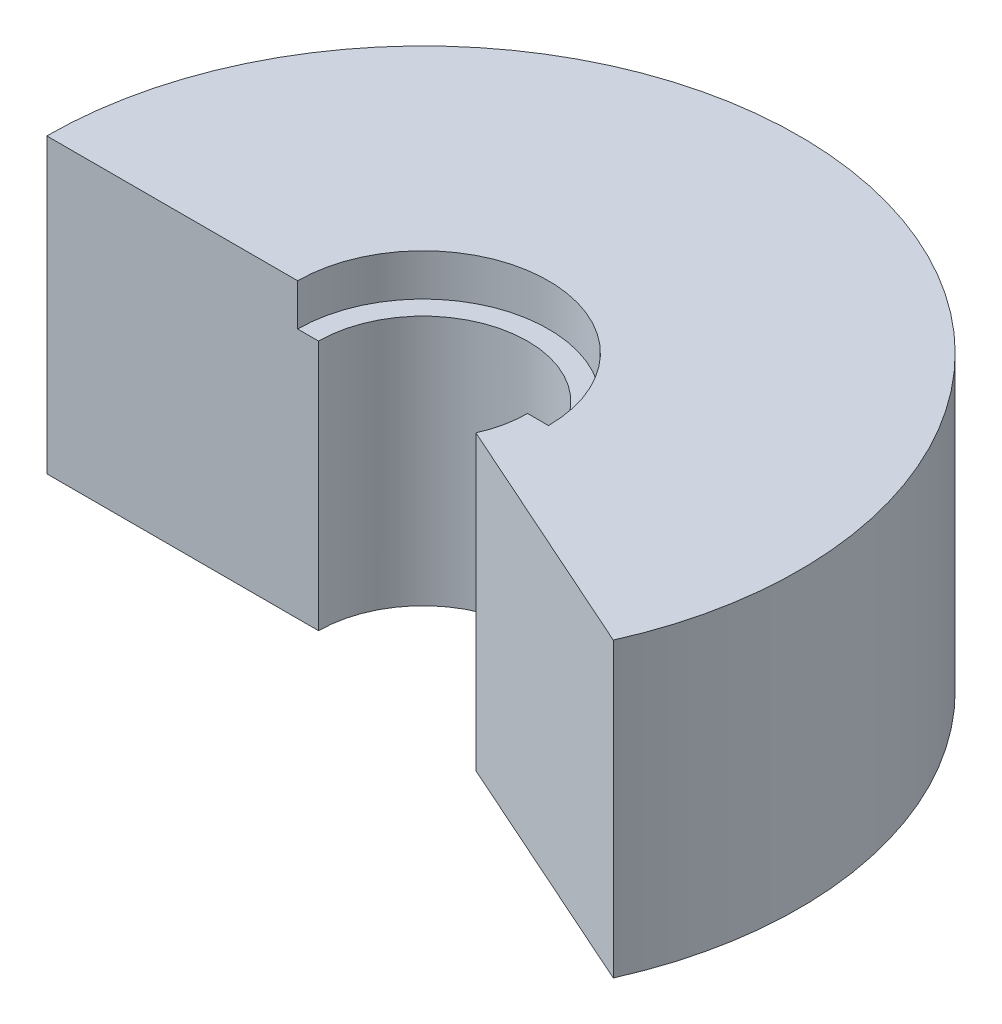
from build123d import *

# Parameters (mm, degrees)
SKETCH1_R           = 9
BOSS_EXTRUDE1_DEPTH = 7
SKETCH2_R           = 2.5
CUT_EXTRUDE4_DEPTH  = 11
CUT_EXTRUDE5_START  = -14
CUT_EXTRUDE5_DEPTH  = 14
CUT_EXTRUDE6_DEPTH  = 1


with BuildPart() as part:
    # Sketch1 → Boss-Extrude1 (new body)
    with BuildSketch(Plane(origin=(0, 0, 0), x_dir=(1, 0, 0), z_dir=(0, 1, 0))):
        with Locations(Location((0, 0, 0), (0, 0, 270))):
            Circle(SKETCH1_R)
    extrude(amount=BOSS_EXTRUDE1_DEPTH)

    # Sketch2 → Cut-Extrude4 (cut)
    with BuildSketch(Plane(origin=(0, 7, 0), x_dir=(1, 0, 0), z_dir=(0, 1, 0))):
        with Locations(Location((0, 0, 0), (0, 0, 270))):
            Circle(SKETCH2_R)
    extrude(amount=-CUT_EXTRUDE4_DEPTH, mode=Mode.SUBTRACT)

    # Sketch16 → Cut-Extrude5 (cut)
    with BuildSketch(Plane(origin=(0, 7, 0), x_dir=(1, 0, 0), z_dir=(0, 1, 0)).offset(CUT_EXTRUDE5_START)):
        with BuildLine():
            Line((2.282849902, -1.019115461), (-2.5, 0))
            Line((-2.5, 0), (-9, 0))
            ThreePointArc((-9, 0), (-1.877482723, -8.801991742), (8.216679694, -3.672352761))
            ThreePointArc((8.216679694, -3.672352761), (8.217469862, -3.670584296), (8.218259648, -3.66881566))
            Line((8.218259648, -3.66881566), (2.282849902, -1.019115461))
        make_face()
    extrude(amount=CUT_EXTRUDE5_DEPTH, mode=Mode.SUBTRACT)

    # Sketch23 → Cut-Extrude6 (cut)
    with BuildSketch(Plane(origin=(0, 7, 0), x_dir=(1, 0, 0), z_dir=(0, 1, 0))):
        with BuildLine():
            ThreePointArc((3, 0), (0, 3), (-3, 0))
            Line((-3, 0), (-2.5, 0))
            ThreePointArc((-2.5, 0), (0, 2.5), (2.5, 0))
            Line((2.5, 0), (3, 0))
        make_face()
    extrude(amount=-CUT_EXTRUDE6_DEPTH, mode=Mode.SUBTRACT)


solid = part.part
